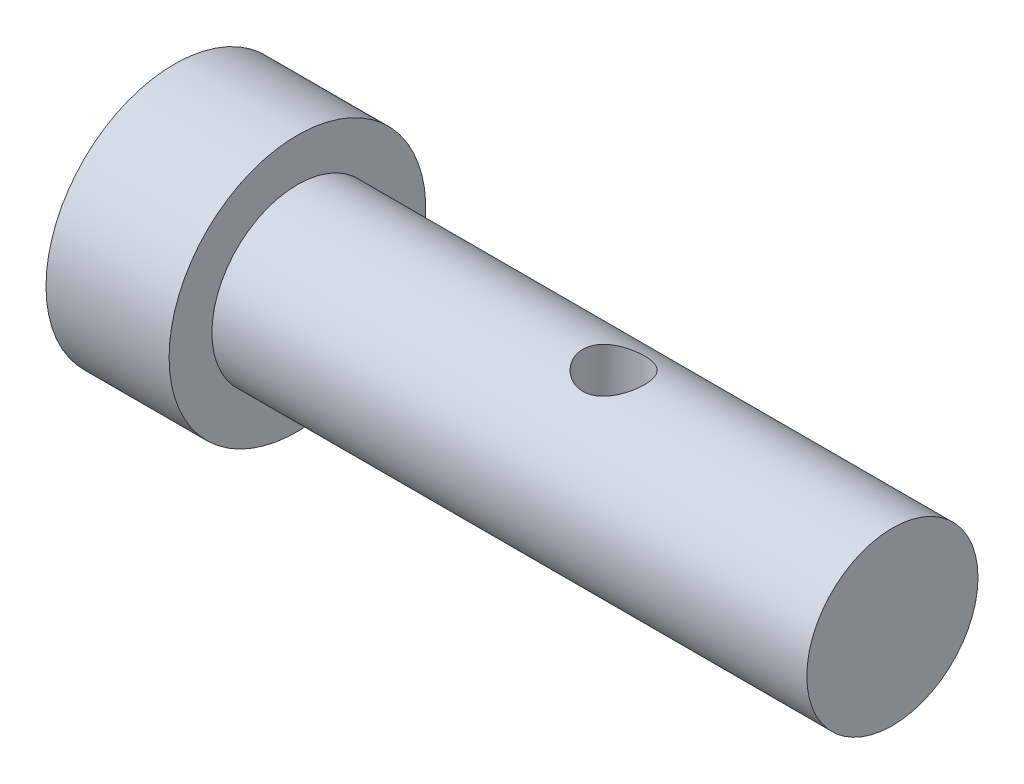
from build123d import *

# Parameters (mm, degrees)
CUT_EXTRUDE1_DEPTH      = 73.203709133
CUT_EXTRUDE1_DEPTH_BACK = 73.203709133
SKETCH4_R               = 3


with BuildPart() as part:
    # Sketch2 → Revolve1 (revolve)
    with BuildSketch(Plane(origin=(0, 0, 0), x_dir=(1, 0, 0), z_dir=(0, 1, 0)), mode=Mode.PRIVATE) as revolve1_sk:
        Polygon((0, 0), (0, 8.345), (-58, 8.345), (-58, 12.5175), (-70, 12.5175), (-70, 0), align=None)
    revolve(revolve1_sk.sketch.rotate(Axis((-70, 0, 0), (1, 0, 0)), 180), axis=Axis((-70, 0, 0), (1, 0, 0)))

    # Sketch4 → Cut-Extrude1 (cut, two sides: drawn at the far end of the back side and taken through both)
    with BuildSketch(Plane(origin=(0, 0, 0), x_dir=(1, 0, 0), z_dir=(0, 1, 0)).offset(-CUT_EXTRUDE1_DEPTH_BACK)):
        with Locations(Location((-27.1809868, 0, 0), (0, 0, 90))):
            Circle(SKETCH4_R)
    extrude(amount=CUT_EXTRUDE1_DEPTH + CUT_EXTRUDE1_DEPTH_BACK, mode=Mode.SUBTRACT)


solid = part.part
